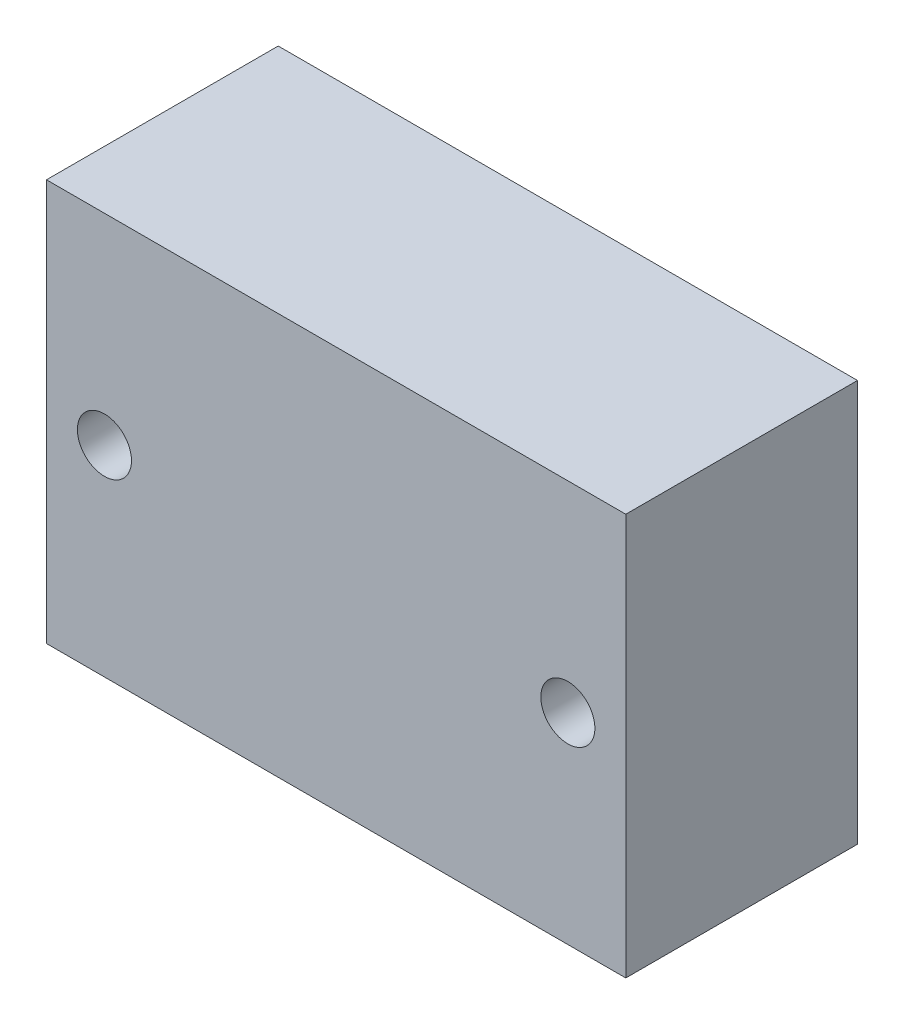
from build123d import *

# Parameters (mm, degrees)
SKETCH1_W           = 75
SKETCH1_H           = 52
SKETCH1_R           = 3.5
BOSS_EXTRUDE1_DEPTH = 30


with BuildPart() as part:
    # Sketch1 → Boss-Extrude1 (new body)
    with BuildSketch(Plane.XY):
        with Locations((37.5, -26)):
            Rectangle(SKETCH1_W, SKETCH1_H)
        with Locations((7.5, -26)):
            Circle(SKETCH1_R, mode=Mode.SUBTRACT)
        with Locations(Location((67.5, -26, 0), (0, 0, 180))):
            Circle(SKETCH1_R, mode=Mode.SUBTRACT)
    extrude(amount=BOSS_EXTRUDE1_DEPTH)


solid = part.part
